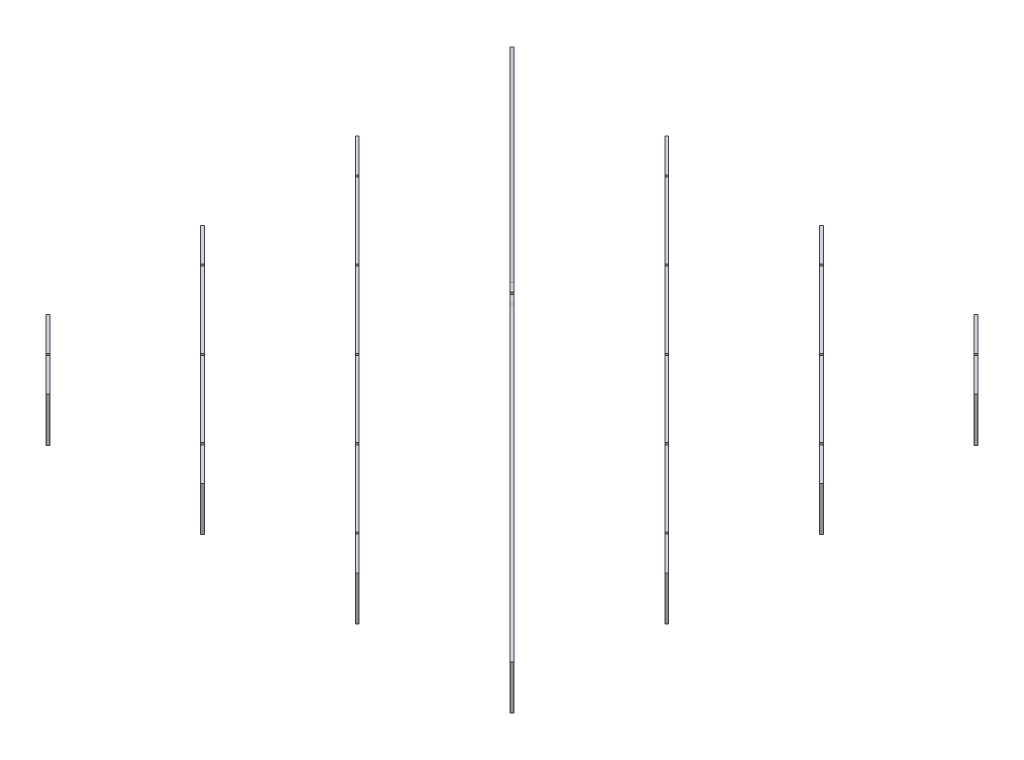
from build123d import *

# Parameters (mm, degrees)
BOSS_EXTRUDE1_DEPTH   = 100
BOSS_EXTRUDE1_2_DEPTH = 100
BOSS_EXTRUDE1_3_DEPTH = 100
BOSS_EXTRUDE1_4_DEPTH = 100
BOSS_EXTRUDE1_5_DEPTH = 100
BOSS_EXTRUDE1_6_DEPTH = 100
BOSS_EXTRUDE1_7_DEPTH = 100
BOSS_EXTRUDE2_START   = -6
BOSS_EXTRUDE2_DEPTH   = 6
SKETCH5_R             = 1.5
SKETCH5_W             = 6
SKETCH5_H             = 100
CUT_EXTRUDE1_DEPTH    = 500.974746831
CUT_EXTRUDE2_START    = -500.974746831
SKETCH6_R             = 1.5
SKETCH6_W             = 6
SKETCH6_H             = 100
CUT_EXTRUDE2_DEPTH    = 500.974746831
CUT_EXTRUDE3_DEPTH    = 6
SKETCH8_W             = 56
SKETCH8_H             = 12
CUT_EXTRUDE4_DEPTH    = 6
SKETCH9_R             = 4
SKETCH9_R_2           = 10
CUT_EXTRUDE5_DEPTH    = 6
CUT_EXTRUDE6_START    = -6
SKETCH10_R            = 3
CUT_EXTRUDE6_DEPTH    = 253.487373414


with BuildPart() as part:
    # Sketch2 → Boss-Extrude1 (new body)
    with BuildSketch(Plane(origin=(0, 0, 0), x_dir=(1, 0, 0), z_dir=(0, 1, 0))):
        Polygon((-605, -449.242640687), (-449.242640687, -605), (-445, -600.757359313), (-600.757359313, -445), align=None)
    extrude(amount=BOSS_EXTRUDE1_DEPTH)


with BuildPart() as body_2:
    # Sketch2 → Boss-Extrude1 2 (new body)
    with BuildSketch(Plane(origin=(0, 0, 0), x_dir=(1, 0, 0), z_dir=(0, 1, 0))):
        Polygon((-605, -99.242640687), (-99.242640687, -605), (-95, -600.757359313), (-600.757359313, -95), align=None)
    extrude(amount=BOSS_EXTRUDE1_2_DEPTH)


with BuildPart() as body_3:
    # Sketch2 → Boss-Extrude1 3 (new body)
    with BuildSketch(Plane(origin=(0, 0, 0), x_dir=(1, 0, 0), z_dir=(0, 1, 0))):
        Polygon((-605, 250.757359313), (250.757359313, -605), (255, -600.757359313), (-600.757359313, 255), align=None)
    extrude(amount=BOSS_EXTRUDE1_3_DEPTH)


with BuildPart() as body_4:
    # Sketch2 → Boss-Extrude1 4 (new body)
    with BuildSketch(Plane(origin=(0, 0, 0), x_dir=(1, 0, 0), z_dir=(0, 1, 0))):
        Polygon((605, -600.757359313), (-600.757359313, 605), (-605, 600.757359313), (600.757359313, -605), align=None)
    extrude(amount=BOSS_EXTRUDE1_4_DEPTH)

    # Sketch4 → Boss-Extrude2 (add)
    with BuildSketch(Plane(origin=(-2.121320344, 0, 2.121320344), x_dir=(0.7071067811865475, 0, 0.7071067811865477), z_dir=(-0.7071067811865477, 0, 0.7071067811865475)).offset(BOSS_EXTRUDE2_START)):
        Polygon((-30, 220), (-852.599205236, 100), (-30, 100), (30, 100), (852.599205236, 100), (30, 220), align=None)
    extrude(amount=BOSS_EXTRUDE2_DEPTH)

    # Sketch7 → Cut-Extrude3 (cut)
    with BuildSketch(Plane(origin=(-2.121320344, 0, 2.121320344), x_dir=(0.7071067811865475, 0, 0.7071067811865477), z_dir=(-0.7071067811865477, 0, 0.7071067811865475))):
        with BuildLine():
            ThreePointArc((-743.962120246, 50), (-746.522780418, 51.060660172), (-745.462120246, 48.5))
            Line((-745.462120246, 48.5), (-745.462120246, 50))
            Line((-745.462120246, 50), (-743.962120246, 50))
        make_face()
        with BuildLine():
            Line((-745.462120246, 50), (-745.462120246, 48.5))
            ThreePointArc((-745.462120246, 48.5), (-744.401460074, 48.939339828), (-743.962120246, 50))
            Line((-743.962120246, 50), (-745.462120246, 50))
        make_face()
        with BuildLine():
            ThreePointArc((-743.962120246, 50), (-746.522780418, 51.060660172), (-745.462120246, 48.5))
            Line((-745.462120246, 48.5), (-745.462120246, 50))
            Line((-745.462120246, 50), (-743.962120246, 50))
        make_face()
        with BuildLine():
            Line((-745.462120246, 50), (-745.462120246, 48.5))
            ThreePointArc((-745.462120246, 48.5), (-744.401460074, 48.939339828), (-743.962120246, 50))
            Line((-743.962120246, 50), (-745.462120246, 50))
        make_face()
        with BuildLine():
            Line((-745.462120246, 0), (-739.462120246, 0))
            Line((-739.462120246, 0), (-739.462120246, 48.5))
            ThreePointArc((-739.462120246, 48.5), (-740.522780418, 48.939339828), (-740.962120246, 50))
            Line((-740.962120246, 50), (-743.962120246, 50))
            ThreePointArc((-743.962120246, 50), (-744.401460074, 48.939339828), (-745.462120246, 48.5))
            Line((-745.462120246, 48.5), (-745.462120246, 0))
        make_face()
        with BuildLine():
            ThreePointArc((-740.962120246, 50), (-740.522780418, 48.939339828), (-739.462120246, 48.5))
            Line((-739.462120246, 48.5), (-739.462120246, 50))
            Line((-739.462120246, 50), (-740.962120246, 50))
        make_face()
        with BuildLine():
            Line((-739.462120246, 50), (-739.462120246, 48.5))
            ThreePointArc((-739.462120246, 48.5), (-738.401460074, 48.939339828), (-737.962120246, 50))
            ThreePointArc((-737.962120246, 50), (-739.462120246, 51.5), (-740.962120246, 50))
            Line((-740.962120246, 50), (-739.462120246, 50))
        make_face()
        with BuildLine():
            ThreePointArc((-740.962120246, 50), (-740.522780418, 48.939339828), (-739.462120246, 48.5))
            Line((-739.462120246, 48.5), (-739.462120246, 50))
            Line((-739.462120246, 50), (-740.962120246, 50))
        make_face()
        with BuildLine():
            Line((-739.462120246, 50), (-739.462120246, 48.5))
            ThreePointArc((-739.462120246, 48.5), (-738.401460074, 48.939339828), (-737.962120246, 50))
            ThreePointArc((-737.962120246, 50), (-739.462120246, 51.5), (-740.962120246, 50))
            Line((-740.962120246, 50), (-739.462120246, 50))
        make_face()
        with BuildLine():
            ThreePointArc((-496.474746831, 50), (-499.035407002, 51.060660172), (-497.974746831, 48.5))
            Line((-497.974746831, 48.5), (-497.974746831, 50))
            Line((-497.974746831, 50), (-496.474746831, 50))
        make_face()
        with BuildLine():
            Line((-497.974746831, 50), (-497.974746831, 48.5))
            ThreePointArc((-497.974746831, 48.5), (-496.914086659, 48.939339828), (-496.474746831, 50))
            Line((-496.474746831, 50), (-497.974746831, 50))
        make_face()
        with BuildLine():
            ThreePointArc((-496.474746831, 50), (-499.035407002, 51.060660172), (-497.974746831, 48.5))
            Line((-497.974746831, 48.5), (-497.974746831, 50))
            Line((-497.974746831, 50), (-496.474746831, 50))
        make_face()
        with BuildLine():
            Line((-497.974746831, 50), (-497.974746831, 48.5))
            ThreePointArc((-497.974746831, 48.5), (-496.914086659, 48.939339828), (-496.474746831, 50))
            Line((-496.474746831, 50), (-497.974746831, 50))
        make_face()
        with BuildLine():
            Line((-497.974746831, 0), (-491.974746831, 0))
            Line((-491.974746831, 0), (-491.974746831, 48.5))
            ThreePointArc((-491.974746831, 48.5), (-493.035407002, 48.939339828), (-493.474746831, 50))
            Line((-493.474746831, 50), (-496.474746831, 50))
            ThreePointArc((-496.474746831, 50), (-496.914086659, 48.939339828), (-497.974746831, 48.5))
            Line((-497.974746831, 48.5), (-497.974746831, 0))
        make_face()
        with BuildLine():
            ThreePointArc((-493.474746831, 50), (-493.035407002, 48.939339828), (-491.974746831, 48.5))
            Line((-491.974746831, 48.5), (-491.974746831, 50))
            Line((-491.974746831, 50), (-493.474746831, 50))
        make_face()
        with BuildLine():
            Line((-491.974746831, 50), (-491.974746831, 48.5))
            ThreePointArc((-491.974746831, 48.5), (-490.914086659, 48.939339828), (-490.474746831, 50))
            ThreePointArc((-490.474746831, 50), (-491.974746831, 51.5), (-493.474746831, 50))
            Line((-493.474746831, 50), (-491.974746831, 50))
        make_face()
        with BuildLine():
            ThreePointArc((-493.474746831, 50), (-493.035407002, 48.939339828), (-491.974746831, 48.5))
            Line((-491.974746831, 48.5), (-491.974746831, 50))
            Line((-491.974746831, 50), (-493.474746831, 50))
        make_face()
        with BuildLine():
            Line((-491.974746831, 50), (-491.974746831, 48.5))
            ThreePointArc((-491.974746831, 48.5), (-490.914086659, 48.939339828), (-490.474746831, 50))
            ThreePointArc((-490.474746831, 50), (-491.974746831, 51.5), (-493.474746831, 50))
            Line((-493.474746831, 50), (-491.974746831, 50))
        make_face()
        with BuildLine():
            ThreePointArc((-242.987373415, 50), (-244.487373415, 51.5), (-245.987373415, 50))
            Line((-245.987373415, 50), (-244.487373415, 50))
            Line((-244.487373415, 50), (-244.487373415, 48.5))
            ThreePointArc((-244.487373415, 48.5), (-243.426713244, 48.939339828), (-242.987373415, 50))
        make_face()
        with BuildLine():
            Line((-244.487373415, 50), (-245.987373415, 50))
            ThreePointArc((-245.987373415, 50), (-245.548033587, 48.939339828), (-244.487373415, 48.5))
            Line((-244.487373415, 48.5), (-244.487373415, 50))
        make_face()
        with BuildLine():
            ThreePointArc((-242.987373415, 50), (-244.487373415, 51.5), (-245.987373415, 50))
            Line((-245.987373415, 50), (-244.487373415, 50))
            Line((-244.487373415, 50), (-244.487373415, 48.5))
            ThreePointArc((-244.487373415, 48.5), (-243.426713244, 48.939339828), (-242.987373415, 50))
        make_face()
        with BuildLine():
            Line((-244.487373415, 50), (-245.987373415, 50))
            ThreePointArc((-245.987373415, 50), (-245.548033587, 48.939339828), (-244.487373415, 48.5))
            Line((-244.487373415, 48.5), (-244.487373415, 50))
        make_face()
        with BuildLine():
            Line((-245.987373415, 50), (-248.987373415, 50))
            ThreePointArc((-248.987373415, 50), (-249.426713244, 48.939339828), (-250.487373415, 48.5))
            Line((-250.487373415, 48.5), (-250.487373415, 0))
            Line((-250.487373415, 0), (-244.487373415, 0))
            Line((-244.487373415, 0), (-244.487373415, 48.5))
            ThreePointArc((-244.487373415, 48.5), (-245.548033587, 48.939339828), (-245.987373415, 50))
        make_face()
        with BuildLine():
            Line((-250.487373415, 48.5), (-250.487373415, 50))
            Line((-250.487373415, 50), (-248.987373415, 50))
            ThreePointArc((-248.987373415, 50), (-251.548033587, 51.060660172), (-250.487373415, 48.5))
        make_face()
        with BuildLine():
            Line((-248.987373415, 50), (-250.487373415, 50))
            Line((-250.487373415, 50), (-250.487373415, 48.5))
            ThreePointArc((-250.487373415, 48.5), (-249.426713244, 48.939339828), (-248.987373415, 50))
        make_face()
        with BuildLine():
            Line((-250.487373415, 48.5), (-250.487373415, 50))
            Line((-250.487373415, 50), (-248.987373415, 50))
            ThreePointArc((-248.987373415, 50), (-251.548033587, 51.060660172), (-250.487373415, 48.5))
        make_face()
        with BuildLine():
            Line((-248.987373415, 50), (-250.487373415, 50))
            Line((-250.487373415, 50), (-250.487373415, 48.5))
            ThreePointArc((-250.487373415, 48.5), (-249.426713244, 48.939339828), (-248.987373415, 50))
        make_face()
        with BuildLine():
            Line((3, 220), (-3, 220))
            Line((-3, 220), (-3, 111.5))
            ThreePointArc((-3, 111.5), (-1.939339828, 111.060660172), (-1.5, 110))
            Line((-1.5, 110), (1.5, 110))
            ThreePointArc((1.5, 110), (1.939339828, 111.060660172), (3, 111.5))
            Line((3, 111.5), (3, 220))
        make_face()
        with BuildLine():
            ThreePointArc((-1.5, 110), (-1.939339828, 111.060660172), (-3, 111.5))
            Line((-3, 111.5), (-3, 110))
            Line((-3, 110), (-1.5, 110))
        make_face()
        with BuildLine():
            Line((-3, 110), (-3, 111.5))
            ThreePointArc((-3, 111.5), (-4.060660172, 108.939339828), (-1.5, 110))
            Line((-1.5, 110), (-3, 110))
        make_face()
        with BuildLine():
            ThreePointArc((-1.5, 110), (-1.939339828, 111.060660172), (-3, 111.5))
            Line((-3, 111.5), (-3, 110))
            Line((-3, 110), (-1.5, 110))
        make_face()
        with BuildLine():
            Line((-3, 110), (-3, 111.5))
            ThreePointArc((-3, 111.5), (-4.060660172, 108.939339828), (-1.5, 110))
            Line((-1.5, 110), (-3, 110))
        make_face()
        with BuildLine():
            ThreePointArc((4.5, 110), (4.060660172, 111.060660172), (3, 111.5))
            Line((3, 111.5), (3, 110))
            Line((3, 110), (1.5, 110))
            ThreePointArc((1.5, 110), (3, 108.5), (4.5, 110))
        make_face()
        with BuildLine():
            Line((3, 110), (3, 111.5))
            ThreePointArc((3, 111.5), (1.939339828, 111.060660172), (1.5, 110))
            Line((1.5, 110), (3, 110))
        make_face()
        with BuildLine():
            ThreePointArc((4.5, 110), (4.060660172, 111.060660172), (3, 111.5))
            Line((3, 111.5), (3, 110))
            Line((3, 110), (1.5, 110))
            ThreePointArc((1.5, 110), (3, 108.5), (4.5, 110))
        make_face()
        with BuildLine():
            Line((3, 110), (3, 111.5))
            ThreePointArc((3, 111.5), (1.939339828, 111.060660172), (1.5, 110))
            Line((1.5, 110), (3, 110))
        make_face()
        with BuildLine():
            ThreePointArc((245.987373415, 50), (243.426713244, 51.060660172), (244.487373415, 48.5))
            Line((244.487373415, 48.5), (244.487373415, 50))
            Line((244.487373415, 50), (245.987373415, 50))
        make_face()
        with BuildLine():
            Line((244.487373415, 50), (244.487373415, 48.5))
            ThreePointArc((244.487373415, 48.5), (245.548033587, 48.939339828), (245.987373415, 50))
            Line((245.987373415, 50), (244.487373415, 50))
        make_face()
        with BuildLine():
            ThreePointArc((245.987373415, 50), (243.426713244, 51.060660172), (244.487373415, 48.5))
            Line((244.487373415, 48.5), (244.487373415, 50))
            Line((244.487373415, 50), (245.987373415, 50))
        make_face()
        with BuildLine():
            Line((244.487373415, 50), (244.487373415, 48.5))
            ThreePointArc((244.487373415, 48.5), (245.548033587, 48.939339828), (245.987373415, 50))
            Line((245.987373415, 50), (244.487373415, 50))
        make_face()
        with BuildLine():
            Line((244.487373415, 48.5), (244.487373415, 0))
            Line((244.487373415, 0), (250.487373415, 0))
            Line((250.487373415, 0), (250.487373415, 48.5))
            ThreePointArc((250.487373415, 48.5), (249.426713244, 48.939339828), (248.987373415, 50))
            Line((248.987373415, 50), (245.987373415, 50))
            ThreePointArc((245.987373415, 50), (245.548033587, 48.939339828), (244.487373415, 48.5))
        make_face()
        with BuildLine():
            ThreePointArc((248.987373415, 50), (249.426713244, 48.939339828), (250.487373415, 48.5))
            Line((250.487373415, 48.5), (250.487373415, 50))
            Line((250.487373415, 50), (248.987373415, 50))
        make_face()
        with BuildLine():
            Line((250.487373415, 50), (250.487373415, 48.5))
            ThreePointArc((250.487373415, 48.5), (251.548033587, 48.939339828), (251.987373415, 50))
            ThreePointArc((251.987373415, 50), (250.487373415, 51.5), (248.987373415, 50))
            Line((248.987373415, 50), (250.487373415, 50))
        make_face()
        with BuildLine():
            ThreePointArc((248.987373415, 50), (249.426713244, 48.939339828), (250.487373415, 48.5))
            Line((250.487373415, 48.5), (250.487373415, 50))
            Line((250.487373415, 50), (248.987373415, 50))
        make_face()
        with BuildLine():
            Line((250.487373415, 50), (250.487373415, 48.5))
            ThreePointArc((250.487373415, 48.5), (251.548033587, 48.939339828), (251.987373415, 50))
            ThreePointArc((251.987373415, 50), (250.487373415, 51.5), (248.987373415, 50))
            Line((248.987373415, 50), (250.487373415, 50))
        make_face()
        with BuildLine():
            ThreePointArc((493.474746831, 50), (490.914086659, 51.060660172), (491.974746831, 48.5))
            Line((491.974746831, 48.5), (491.974746831, 50))
            Line((491.974746831, 50), (493.474746831, 50))
        make_face()
        with BuildLine():
            Line((491.974746831, 50), (491.974746831, 48.5))
            ThreePointArc((491.974746831, 48.5), (493.035407002, 48.939339828), (493.474746831, 50))
            Line((493.474746831, 50), (491.974746831, 50))
        make_face()
        with BuildLine():
            ThreePointArc((493.474746831, 50), (490.914086659, 51.060660172), (491.974746831, 48.5))
            Line((491.974746831, 48.5), (491.974746831, 50))
            Line((491.974746831, 50), (493.474746831, 50))
        make_face()
        with BuildLine():
            Line((491.974746831, 50), (491.974746831, 48.5))
            ThreePointArc((491.974746831, 48.5), (493.035407002, 48.939339828), (493.474746831, 50))
            Line((493.474746831, 50), (491.974746831, 50))
        make_face()
        with BuildLine():
            Line((491.974746831, 48.5), (491.974746831, 0))
            Line((491.974746831, 0), (497.974746831, 0))
            Line((497.974746831, 0), (497.974746831, 48.5))
            ThreePointArc((497.974746831, 48.5), (496.914086659, 48.939339828), (496.474746831, 50))
            Line((496.474746831, 50), (493.474746831, 50))
            ThreePointArc((493.474746831, 50), (493.035407002, 48.939339828), (491.974746831, 48.5))
        make_face()
        with BuildLine():
            ThreePointArc((496.474746831, 50), (496.914086659, 48.939339828), (497.974746831, 48.5))
            Line((497.974746831, 48.5), (497.974746831, 50))
            Line((497.974746831, 50), (496.474746831, 50))
        make_face()
        with BuildLine():
            Line((497.974746831, 50), (497.974746831, 48.5))
            ThreePointArc((497.974746831, 48.5), (499.035407002, 48.939339828), (499.474746831, 50))
            ThreePointArc((499.474746831, 50), (497.974746831, 51.5), (496.474746831, 50))
            Line((496.474746831, 50), (497.974746831, 50))
        make_face()
        with BuildLine():
            ThreePointArc((496.474746831, 50), (496.914086659, 48.939339828), (497.974746831, 48.5))
            Line((497.974746831, 48.5), (497.974746831, 50))
            Line((497.974746831, 50), (496.474746831, 50))
        make_face()
        with BuildLine():
            Line((497.974746831, 50), (497.974746831, 48.5))
            ThreePointArc((497.974746831, 48.5), (499.035407002, 48.939339828), (499.474746831, 50))
            ThreePointArc((499.474746831, 50), (497.974746831, 51.5), (496.474746831, 50))
            Line((496.474746831, 50), (497.974746831, 50))
        make_face()
        with BuildLine():
            ThreePointArc((740.962120246, 50), (738.401460074, 51.060660172), (739.462120246, 48.5))
            Line((739.462120246, 48.5), (739.462120246, 50))
            Line((739.462120246, 50), (740.962120246, 50))
        make_face()
        with BuildLine():
            Line((739.462120246, 50), (739.462120246, 48.5))
            ThreePointArc((739.462120246, 48.5), (740.522780418, 48.939339828), (740.962120246, 50))
            Line((740.962120246, 50), (739.462120246, 50))
        make_face()
        with BuildLine():
            ThreePointArc((740.962120246, 50), (738.401460074, 51.060660172), (739.462120246, 48.5))
            Line((739.462120246, 48.5), (739.462120246, 50))
            Line((739.462120246, 50), (740.962120246, 50))
        make_face()
        with BuildLine():
            Line((739.462120246, 50), (739.462120246, 48.5))
            ThreePointArc((739.462120246, 48.5), (740.522780418, 48.939339828), (740.962120246, 50))
            Line((740.962120246, 50), (739.462120246, 50))
        make_face()
        with BuildLine():
            Line((739.462120246, 48.5), (739.462120246, 0))
            Line((739.462120246, 0), (745.462120246, 0))
            Line((745.462120246, 0), (745.462120246, 48.5))
            ThreePointArc((745.462120246, 48.5), (744.401460074, 48.939339828), (743.962120246, 50))
            Line((743.962120246, 50), (740.962120246, 50))
            ThreePointArc((740.962120246, 50), (740.522780418, 48.939339828), (739.462120246, 48.5))
        make_face()
        with BuildLine():
            ThreePointArc((743.962120246, 50), (744.401460074, 48.939339828), (745.462120246, 48.5))
            Line((745.462120246, 48.5), (745.462120246, 50))
            Line((745.462120246, 50), (743.962120246, 50))
        make_face()
        with BuildLine():
            Line((745.462120246, 50), (745.462120246, 48.5))
            ThreePointArc((745.462120246, 48.5), (746.522780418, 48.939339828), (746.962120246, 50))
            ThreePointArc((746.962120246, 50), (745.462120246, 51.5), (743.962120246, 50))
            Line((743.962120246, 50), (745.462120246, 50))
        make_face()
        with BuildLine():
            ThreePointArc((743.962120246, 50), (744.401460074, 48.939339828), (745.462120246, 48.5))
            Line((745.462120246, 48.5), (745.462120246, 50))
            Line((745.462120246, 50), (743.962120246, 50))
        make_face()
        with BuildLine():
            Line((745.462120246, 50), (745.462120246, 48.5))
            ThreePointArc((745.462120246, 48.5), (746.522780418, 48.939339828), (746.962120246, 50))
            ThreePointArc((746.962120246, 50), (745.462120246, 51.5), (743.962120246, 50))
            Line((743.962120246, 50), (745.462120246, 50))
        make_face()
    extrude(amount=-CUT_EXTRUDE3_DEPTH, mode=Mode.SUBTRACT)

    # Sketch8 → Cut-Extrude4 (cut)
    with BuildSketch(Plane(origin=(-2.121320344, 0, 2.121320344), x_dir=(0.7071067811865475, 0, 0.7071067811865477), z_dir=(-0.7071067811865477, 0, 0.7071067811865475))):
        with Locations((371.231060123, 22)):
            Rectangle(SKETCH8_W, SKETCH8_H)
        with Locations((-371.231060123, 22)):
            Rectangle(SKETCH8_W, SKETCH8_H)
    extrude(amount=-CUT_EXTRUDE4_DEPTH, mode=Mode.SUBTRACT)

    # Sketch9 → Cut-Extrude5 (cut)
    with BuildSketch(Plane(origin=(2.121320344, 0, -2.121320344), x_dir=(-0.7071067811865475, 0, -0.7071067811865477), z_dir=(0.7071067811865477, 0, -0.7071067811865475))):
        with Locations((123.743686708, 64)):
            Circle(SKETCH9_R)
        with Locations((123.743686708, 84)):
            Circle(SKETCH9_R)
        with Locations((40, 74)):
            Circle(SKETCH9_R_2)
        with Locations((-40, 74)):
            Circle(SKETCH9_R_2)
        with Locations((-123.743686708, 84)):
            Circle(SKETCH9_R)
        with Locations((-123.743686708, 64)):
            Circle(SKETCH9_R)
    extrude(amount=-CUT_EXTRUDE5_DEPTH, mode=Mode.SUBTRACT)


with BuildPart() as body_5:
    # Sketch2 → Boss-Extrude1 5 (new body)
    with BuildSketch(Plane(origin=(0, 0, 0), x_dir=(1, 0, 0), z_dir=(0, 1, 0))):
        Polygon((-255, 600.757359313), (600.757359313, -255), (605, -250.757359313), (-250.757359313, 605), align=None)
    extrude(amount=BOSS_EXTRUDE1_5_DEPTH)


with BuildPart() as body_6:
    # Sketch2 → Boss-Extrude1 6 (new body)
    with BuildSketch(Plane(origin=(0, 0, 0), x_dir=(1, 0, 0), z_dir=(0, 1, 0))):
        Polygon((95, 600.757359313), (600.757359313, 95), (605, 99.242640687), (99.242640687, 605), align=None)
    extrude(amount=BOSS_EXTRUDE1_6_DEPTH)


with BuildPart() as body_7:
    # Sketch2 → Boss-Extrude1 7 (new body)
    with BuildSketch(Plane(origin=(0, 0, 0), x_dir=(1, 0, 0), z_dir=(0, 1, 0))):
        Polygon((445, 600.757359313), (600.757359313, 445), (605, 449.242640687), (449.242640687, 605), align=None)
    extrude(amount=BOSS_EXTRUDE1_7_DEPTH)


with BuildPart() as cut_extrude1_tool:
    # Sketch5 → Cut-Extrude1 (new body)
    with BuildSketch(Plane(origin=(-527.121320344, 0, 527.121320344), x_dir=(0.707106781186544, 0, 0.7071067811865511), z_dir=(-0.7071067811865511, 0, 0.707106781186544))):
        with Locations((497.974746831, 50)):
            Circle(SKETCH5_R)
        with Locations((491.974746831, 50)):
            Circle(SKETCH5_R)
        with Locations((494.974746831, 100)):
            Rectangle(SKETCH5_W, SKETCH5_H)
        with BuildLine():
            ThreePointArc((493.474746831, 50), (493.035407002, 51.060660172), (491.974746831, 51.5))
            Line((491.974746831, 51.5), (491.974746831, 50))
            Line((491.974746831, 50), (493.474746831, 50))
        make_face()
        with BuildLine():
            Line((491.974746831, 50), (491.974746831, 51.5))
            ThreePointArc((491.974746831, 51.5), (490.914086659, 48.939339828), (493.474746831, 50))
            Line((493.474746831, 50), (491.974746831, 50))
        make_face()
        with BuildLine():
            ThreePointArc((493.474746831, 50), (493.035407002, 51.060660172), (491.974746831, 51.5))
            Line((491.974746831, 51.5), (491.974746831, 50))
            Line((491.974746831, 50), (493.474746831, 50))
        make_face()
        with BuildLine():
            Line((491.974746831, 50), (491.974746831, 51.5))
            ThreePointArc((491.974746831, 51.5), (490.914086659, 48.939339828), (493.474746831, 50))
            Line((493.474746831, 50), (491.974746831, 50))
        make_face()
        with BuildLine():
            ThreePointArc((499.474746831, 50), (499.035407002, 51.060660172), (497.974746831, 51.5))
            Line((497.974746831, 51.5), (497.974746831, 50))
            Line((497.974746831, 50), (496.474746831, 50))
            ThreePointArc((496.474746831, 50), (497.974746831, 48.5), (499.474746831, 50))
        make_face()
        with BuildLine():
            Line((497.974746831, 50), (497.974746831, 51.5))
            ThreePointArc((497.974746831, 51.5), (496.914086659, 51.060660172), (496.474746831, 50))
            Line((496.474746831, 50), (497.974746831, 50))
        make_face()
        with BuildLine():
            ThreePointArc((499.474746831, 50), (499.035407002, 51.060660172), (497.974746831, 51.5))
            Line((497.974746831, 51.5), (497.974746831, 50))
            Line((497.974746831, 50), (496.474746831, 50))
            ThreePointArc((496.474746831, 50), (497.974746831, 48.5), (499.474746831, 50))
        make_face()
        with BuildLine():
            Line((497.974746831, 50), (497.974746831, 51.5))
            ThreePointArc((497.974746831, 51.5), (496.914086659, 51.060660172), (496.474746831, 50))
            Line((496.474746831, 50), (497.974746831, 50))
        make_face()
        with Locations((250.487373415, 50)):
            Circle(SKETCH5_R)
        with Locations((244.487373415, 50)):
            Circle(SKETCH5_R)
        with Locations((247.487373415, 100)):
            Rectangle(SKETCH5_W, SKETCH5_H)
        with BuildLine():
            ThreePointArc((245.987373415, 50), (245.548033587, 51.060660172), (244.487373415, 51.5))
            Line((244.487373415, 51.5), (244.487373415, 50))
            Line((244.487373415, 50), (245.987373415, 50))
        make_face()
        with BuildLine():
            Line((244.487373415, 50), (244.487373415, 51.5))
            ThreePointArc((244.487373415, 51.5), (243.426713244, 48.939339828), (245.987373415, 50))
            Line((245.987373415, 50), (244.487373415, 50))
        make_face()
        with BuildLine():
            ThreePointArc((245.987373415, 50), (245.548033587, 51.060660172), (244.487373415, 51.5))
            Line((244.487373415, 51.5), (244.487373415, 50))
            Line((244.487373415, 50), (245.987373415, 50))
        make_face()
        with BuildLine():
            Line((244.487373415, 50), (244.487373415, 51.5))
            ThreePointArc((244.487373415, 51.5), (243.426713244, 48.939339828), (245.987373415, 50))
            Line((245.987373415, 50), (244.487373415, 50))
        make_face()
        with BuildLine():
            ThreePointArc((251.987373415, 50), (251.548033587, 51.060660172), (250.487373415, 51.5))
            Line((250.487373415, 51.5), (250.487373415, 50))
            Line((250.487373415, 50), (248.987373415, 50))
            ThreePointArc((248.987373415, 50), (250.487373415, 48.5), (251.987373415, 50))
        make_face()
        with BuildLine():
            Line((250.487373415, 50), (250.487373415, 51.5))
            ThreePointArc((250.487373415, 51.5), (249.426713244, 51.060660172), (248.987373415, 50))
            Line((248.987373415, 50), (250.487373415, 50))
        make_face()
        with BuildLine():
            ThreePointArc((251.987373415, 50), (251.548033587, 51.060660172), (250.487373415, 51.5))
            Line((250.487373415, 51.5), (250.487373415, 50))
            Line((250.487373415, 50), (248.987373415, 50))
            ThreePointArc((248.987373415, 50), (250.487373415, 48.5), (251.987373415, 50))
        make_face()
        with BuildLine():
            Line((250.487373415, 50), (250.487373415, 51.5))
            ThreePointArc((250.487373415, 51.5), (249.426713244, 51.060660172), (248.987373415, 50))
            Line((248.987373415, 50), (250.487373415, 50))
        make_face()
        with BuildLine():
            Line((3, 100), (-3, 100))
            Line((-3, 100), (-3, 51.5))
            ThreePointArc((-3, 51.5), (-1.939339828, 51.060660172), (-1.5, 50))
            Line((-1.5, 50), (1.5, 50))
            ThreePointArc((1.5, 50), (1.939339828, 51.060660172), (3, 51.5))
            Line((3, 51.5), (3, 100))
        make_face()
        with BuildLine():
            ThreePointArc((-1.5, 50), (-1.939339828, 51.060660172), (-3, 51.5))
            Line((-3, 51.5), (-3, 50))
            Line((-3, 50), (-1.5, 50))
        make_face()
        with BuildLine():
            Line((-3, 50), (-3, 51.5))
            ThreePointArc((-3, 51.5), (-4.060660172, 48.939339828), (-1.5, 50))
            Line((-1.5, 50), (-3, 50))
        make_face()
        with BuildLine():
            ThreePointArc((-1.5, 50), (-1.939339828, 51.060660172), (-3, 51.5))
            Line((-3, 51.5), (-3, 50))
            Line((-3, 50), (-1.5, 50))
        make_face()
        with BuildLine():
            Line((-3, 50), (-3, 51.5))
            ThreePointArc((-3, 51.5), (-4.060660172, 48.939339828), (-1.5, 50))
            Line((-1.5, 50), (-3, 50))
        make_face()
        with BuildLine():
            ThreePointArc((4.5, 50), (4.060660172, 51.060660172), (3, 51.5))
            Line((3, 51.5), (3, 50))
            Line((3, 50), (1.5, 50))
            ThreePointArc((1.5, 50), (3, 48.5), (4.5, 50))
        make_face()
        with BuildLine():
            Line((3, 50), (3, 51.5))
            ThreePointArc((3, 51.5), (1.939339828, 51.060660172), (1.5, 50))
            Line((1.5, 50), (3, 50))
        make_face()
        with BuildLine():
            ThreePointArc((4.5, 50), (4.060660172, 51.060660172), (3, 51.5))
            Line((3, 51.5), (3, 50))
            Line((3, 50), (1.5, 50))
            ThreePointArc((1.5, 50), (3, 48.5), (4.5, 50))
        make_face()
        with BuildLine():
            Line((3, 50), (3, 51.5))
            ThreePointArc((3, 51.5), (1.939339828, 51.060660172), (1.5, 50))
            Line((1.5, 50), (3, 50))
        make_face()
        with Locations((-244.487373415, 50)):
            Circle(SKETCH5_R)
        with Locations((-250.487373415, 50)):
            Circle(SKETCH5_R)
        with Locations((-247.487373415, 100)):
            Rectangle(SKETCH5_W, SKETCH5_H)
        with BuildLine():
            ThreePointArc((-248.987373415, 50), (-249.426713244, 51.060660172), (-250.487373415, 51.5))
            Line((-250.487373415, 51.5), (-250.487373415, 50))
            Line((-250.487373415, 50), (-248.987373415, 50))
        make_face()
        with BuildLine():
            Line((-250.487373415, 50), (-250.487373415, 51.5))
            ThreePointArc((-250.487373415, 51.5), (-251.548033587, 48.939339828), (-248.987373415, 50))
            Line((-248.987373415, 50), (-250.487373415, 50))
        make_face()
        with BuildLine():
            ThreePointArc((-248.987373415, 50), (-249.426713244, 51.060660172), (-250.487373415, 51.5))
            Line((-250.487373415, 51.5), (-250.487373415, 50))
            Line((-250.487373415, 50), (-248.987373415, 50))
        make_face()
        with BuildLine():
            Line((-250.487373415, 50), (-250.487373415, 51.5))
            ThreePointArc((-250.487373415, 51.5), (-251.548033587, 48.939339828), (-248.987373415, 50))
            Line((-248.987373415, 50), (-250.487373415, 50))
        make_face()
        with BuildLine():
            ThreePointArc((-242.987373415, 50), (-243.426713244, 51.060660172), (-244.487373415, 51.5))
            Line((-244.487373415, 51.5), (-244.487373415, 50))
            Line((-244.487373415, 50), (-245.987373415, 50))
            ThreePointArc((-245.987373415, 50), (-244.487373415, 48.5), (-242.987373415, 50))
        make_face()
        with BuildLine():
            Line((-244.487373415, 50), (-244.487373415, 51.5))
            ThreePointArc((-244.487373415, 51.5), (-245.548033587, 51.060660172), (-245.987373415, 50))
            Line((-245.987373415, 50), (-244.487373415, 50))
        make_face()
        with BuildLine():
            ThreePointArc((-242.987373415, 50), (-243.426713244, 51.060660172), (-244.487373415, 51.5))
            Line((-244.487373415, 51.5), (-244.487373415, 50))
            Line((-244.487373415, 50), (-245.987373415, 50))
            ThreePointArc((-245.987373415, 50), (-244.487373415, 48.5), (-242.987373415, 50))
        make_face()
        with BuildLine():
            Line((-244.487373415, 50), (-244.487373415, 51.5))
            ThreePointArc((-244.487373415, 51.5), (-245.548033587, 51.060660172), (-245.987373415, 50))
            Line((-245.987373415, 50), (-244.487373415, 50))
        make_face()
        with Locations((-491.974746831, 50)):
            Circle(SKETCH5_R)
        with Locations((-497.974746831, 50)):
            Circle(SKETCH5_R)
        with Locations((-494.974746831, 100)):
            Rectangle(SKETCH5_W, SKETCH5_H)
        with BuildLine():
            ThreePointArc((-496.474746831, 50), (-496.914086659, 51.060660172), (-497.974746831, 51.5))
            Line((-497.974746831, 51.5), (-497.974746831, 50))
            Line((-497.974746831, 50), (-496.474746831, 50))
        make_face()
        with BuildLine():
            Line((-497.974746831, 50), (-497.974746831, 51.5))
            ThreePointArc((-497.974746831, 51.5), (-499.035407002, 48.939339828), (-496.474746831, 50))
            Line((-496.474746831, 50), (-497.974746831, 50))
        make_face()
        with BuildLine():
            ThreePointArc((-496.474746831, 50), (-496.914086659, 51.060660172), (-497.974746831, 51.5))
            Line((-497.974746831, 51.5), (-497.974746831, 50))
            Line((-497.974746831, 50), (-496.474746831, 50))
        make_face()
        with BuildLine():
            Line((-497.974746831, 50), (-497.974746831, 51.5))
            ThreePointArc((-497.974746831, 51.5), (-499.035407002, 48.939339828), (-496.474746831, 50))
            Line((-496.474746831, 50), (-497.974746831, 50))
        make_face()
        with BuildLine():
            ThreePointArc((-490.474746831, 50), (-490.914086659, 51.060660172), (-491.974746831, 51.5))
            Line((-491.974746831, 51.5), (-491.974746831, 50))
            Line((-491.974746831, 50), (-493.474746831, 50))
            ThreePointArc((-493.474746831, 50), (-491.974746831, 48.5), (-490.474746831, 50))
        make_face()
        with BuildLine():
            Line((-491.974746831, 50), (-491.974746831, 51.5))
            ThreePointArc((-491.974746831, 51.5), (-493.035407002, 51.060660172), (-493.474746831, 50))
            Line((-493.474746831, 50), (-491.974746831, 50))
        make_face()
        with BuildLine():
            ThreePointArc((-490.474746831, 50), (-490.914086659, 51.060660172), (-491.974746831, 51.5))
            Line((-491.974746831, 51.5), (-491.974746831, 50))
            Line((-491.974746831, 50), (-493.474746831, 50))
            ThreePointArc((-493.474746831, 50), (-491.974746831, 48.5), (-490.474746831, 50))
        make_face()
        with BuildLine():
            Line((-491.974746831, 50), (-491.974746831, 51.5))
            ThreePointArc((-491.974746831, 51.5), (-493.035407002, 51.060660172), (-493.474746831, 50))
            Line((-493.474746831, 50), (-491.974746831, 50))
        make_face()
    extrude(amount=-CUT_EXTRUDE1_DEPTH)


with BuildPart() as part_1:
    add(part.part)

    # Cut-Extrude1: cut by cut_extrude1_tool
    add(cut_extrude1_tool.part, mode=Mode.SUBTRACT)


with BuildPart() as body_2_1:
    add(body_2.part)

    # Cut-Extrude1: cut by cut_extrude1_tool
    add(cut_extrude1_tool.part, mode=Mode.SUBTRACT)


with BuildPart() as body_3_1:
    add(body_3.part)

    # Cut-Extrude1: cut by cut_extrude1_tool
    add(cut_extrude1_tool.part, mode=Mode.SUBTRACT)


with BuildPart() as cut_extrude2_tool:
    # Sketch6 → Cut-Extrude2 (new body)
    with BuildSketch(Plane(origin=(527.121320344, 0, -527.121320344), x_dir=(-0.7071067811865511, 0, -0.707106781186544), z_dir=(0.707106781186544, 0, -0.7071067811865511)).offset(CUT_EXTRUDE2_START)):
        with Locations((-491.974746831, 50)):
            Circle(SKETCH6_R)
        with Locations((-497.974746831, 50)):
            Circle(SKETCH6_R)
        with Locations((-494.974746831, 100)):
            Rectangle(SKETCH6_W, SKETCH6_H)
        with BuildLine():
            ThreePointArc((-497.974746831, 51.5), (-499.035407002, 48.939339828), (-496.474746831, 50))
            Line((-496.474746831, 50), (-497.974746831, 50))
            Line((-497.974746831, 50), (-497.974746831, 51.5))
        make_face()
        with BuildLine():
            Line((-497.974746831, 50), (-496.474746831, 50))
            ThreePointArc((-496.474746831, 50), (-496.914086659, 51.060660172), (-497.974746831, 51.5))
            Line((-497.974746831, 51.5), (-497.974746831, 50))
        make_face()
        with BuildLine():
            ThreePointArc((-497.974746831, 51.5), (-499.035407002, 48.939339828), (-496.474746831, 50))
            Line((-496.474746831, 50), (-497.974746831, 50))
            Line((-497.974746831, 50), (-497.974746831, 51.5))
        make_face()
        with BuildLine():
            Line((-497.974746831, 50), (-496.474746831, 50))
            ThreePointArc((-496.474746831, 50), (-496.914086659, 51.060660172), (-497.974746831, 51.5))
            Line((-497.974746831, 51.5), (-497.974746831, 50))
        make_face()
        with BuildLine():
            Line((-493.474746831, 50), (-491.974746831, 50))
            Line((-491.974746831, 50), (-491.974746831, 51.5))
            ThreePointArc((-491.974746831, 51.5), (-493.035407002, 51.060660172), (-493.474746831, 50))
        make_face()
        with BuildLine():
            Line((-491.974746831, 51.5), (-491.974746831, 50))
            Line((-491.974746831, 50), (-493.474746831, 50))
            ThreePointArc((-493.474746831, 50), (-491.974746831, 48.5), (-490.474746831, 50))
            ThreePointArc((-490.474746831, 50), (-490.914086659, 51.060660172), (-491.974746831, 51.5))
        make_face()
        with BuildLine():
            Line((-493.474746831, 50), (-491.974746831, 50))
            Line((-491.974746831, 50), (-491.974746831, 51.5))
            ThreePointArc((-491.974746831, 51.5), (-493.035407002, 51.060660172), (-493.474746831, 50))
        make_face()
        with BuildLine():
            Line((-491.974746831, 51.5), (-491.974746831, 50))
            Line((-491.974746831, 50), (-493.474746831, 50))
            ThreePointArc((-493.474746831, 50), (-491.974746831, 48.5), (-490.474746831, 50))
            ThreePointArc((-490.474746831, 50), (-490.914086659, 51.060660172), (-491.974746831, 51.5))
        make_face()
        with Locations((-244.487373415, 50)):
            Circle(SKETCH6_R)
        with Locations((-250.487373415, 50)):
            Circle(SKETCH6_R)
        with Locations((-247.487373415, 100)):
            Rectangle(SKETCH6_W, SKETCH6_H)
        with BuildLine():
            ThreePointArc((-250.487373415, 51.5), (-251.548033587, 48.939339828), (-248.987373415, 50))
            Line((-248.987373415, 50), (-250.487373415, 50))
            Line((-250.487373415, 50), (-250.487373415, 51.5))
        make_face()
        with BuildLine():
            Line((-250.487373415, 50), (-248.987373415, 50))
            ThreePointArc((-248.987373415, 50), (-249.426713244, 51.060660172), (-250.487373415, 51.5))
            Line((-250.487373415, 51.5), (-250.487373415, 50))
        make_face()
        with BuildLine():
            ThreePointArc((-250.487373415, 51.5), (-251.548033587, 48.939339828), (-248.987373415, 50))
            Line((-248.987373415, 50), (-250.487373415, 50))
            Line((-250.487373415, 50), (-250.487373415, 51.5))
        make_face()
        with BuildLine():
            Line((-250.487373415, 50), (-248.987373415, 50))
            ThreePointArc((-248.987373415, 50), (-249.426713244, 51.060660172), (-250.487373415, 51.5))
            Line((-250.487373415, 51.5), (-250.487373415, 50))
        make_face()
        with BuildLine():
            Line((-245.987373415, 50), (-244.487373415, 50))
            Line((-244.487373415, 50), (-244.487373415, 51.5))
            ThreePointArc((-244.487373415, 51.5), (-245.548033587, 51.060660172), (-245.987373415, 50))
        make_face()
        with BuildLine():
            Line((-244.487373415, 51.5), (-244.487373415, 50))
            Line((-244.487373415, 50), (-245.987373415, 50))
            ThreePointArc((-245.987373415, 50), (-244.487373415, 48.5), (-242.987373415, 50))
            ThreePointArc((-242.987373415, 50), (-243.426713244, 51.060660172), (-244.487373415, 51.5))
        make_face()
        with BuildLine():
            Line((-245.987373415, 50), (-244.487373415, 50))
            Line((-244.487373415, 50), (-244.487373415, 51.5))
            ThreePointArc((-244.487373415, 51.5), (-245.548033587, 51.060660172), (-245.987373415, 50))
        make_face()
        with BuildLine():
            Line((-244.487373415, 51.5), (-244.487373415, 50))
            Line((-244.487373415, 50), (-245.987373415, 50))
            ThreePointArc((-245.987373415, 50), (-244.487373415, 48.5), (-242.987373415, 50))
            ThreePointArc((-242.987373415, 50), (-243.426713244, 51.060660172), (-244.487373415, 51.5))
        make_face()
        with BuildLine():
            Line((3, 100), (-3, 100))
            Line((-3, 100), (-3, 51.5))
            ThreePointArc((-3, 51.5), (-1.939339828, 51.060660172), (-1.5, 50))
            Line((-1.5, 50), (1.5, 50))
            ThreePointArc((1.5, 50), (1.939339828, 51.060660172), (3, 51.5))
            Line((3, 51.5), (3, 100))
        make_face()
        with BuildLine():
            ThreePointArc((4.5, 50), (4.060660172, 51.060660172), (3, 51.5))
            Line((3, 51.5), (3, 50))
            Line((3, 50), (1.5, 50))
            ThreePointArc((1.5, 50), (3, 48.5), (4.5, 50))
        make_face()
        with BuildLine():
            Line((3, 50), (3, 51.5))
            ThreePointArc((3, 51.5), (1.939339828, 51.060660172), (1.5, 50))
            Line((1.5, 50), (3, 50))
        make_face()
        with BuildLine():
            ThreePointArc((4.5, 50), (4.060660172, 51.060660172), (3, 51.5))
            Line((3, 51.5), (3, 50))
            Line((3, 50), (1.5, 50))
            ThreePointArc((1.5, 50), (3, 48.5), (4.5, 50))
        make_face()
        with BuildLine():
            Line((3, 50), (3, 51.5))
            ThreePointArc((3, 51.5), (1.939339828, 51.060660172), (1.5, 50))
            Line((1.5, 50), (3, 50))
        make_face()
        with BuildLine():
            ThreePointArc((-1.5, 50), (-1.939339828, 51.060660172), (-3, 51.5))
            Line((-3, 51.5), (-3, 50))
            Line((-3, 50), (-1.5, 50))
        make_face()
        with BuildLine():
            Line((-3, 50), (-3, 51.5))
            ThreePointArc((-3, 51.5), (-4.060660172, 48.939339828), (-1.5, 50))
            Line((-1.5, 50), (-3, 50))
        make_face()
        with BuildLine():
            ThreePointArc((-1.5, 50), (-1.939339828, 51.060660172), (-3, 51.5))
            Line((-3, 51.5), (-3, 50))
            Line((-3, 50), (-1.5, 50))
        make_face()
        with BuildLine():
            Line((-3, 50), (-3, 51.5))
            ThreePointArc((-3, 51.5), (-4.060660172, 48.939339828), (-1.5, 50))
            Line((-1.5, 50), (-3, 50))
        make_face()
        with BuildLine():
            ThreePointArc((245.987373415, 50), (245.548033587, 51.060660172), (244.487373415, 51.5))
            Line((244.487373415, 51.5), (244.487373415, 50))
            Line((244.487373415, 50), (245.987373415, 50))
        make_face()
        with BuildLine():
            Line((244.487373415, 50), (244.487373415, 51.5))
            ThreePointArc((244.487373415, 51.5), (243.426713244, 48.939339828), (245.987373415, 50))
            Line((245.987373415, 50), (244.487373415, 50))
        make_face()
        with BuildLine():
            ThreePointArc((245.987373415, 50), (245.548033587, 51.060660172), (244.487373415, 51.5))
            Line((244.487373415, 51.5), (244.487373415, 50))
            Line((244.487373415, 50), (245.987373415, 50))
        make_face()
        with BuildLine():
            Line((244.487373415, 50), (244.487373415, 51.5))
            ThreePointArc((244.487373415, 51.5), (243.426713244, 48.939339828), (245.987373415, 50))
            Line((245.987373415, 50), (244.487373415, 50))
        make_face()
        with Locations((250.487373415, 50)):
            Circle(SKETCH6_R)
        with Locations((244.487373415, 50)):
            Circle(SKETCH6_R)
        with Locations((247.487373415, 100)):
            Rectangle(SKETCH6_W, SKETCH6_H)
        with BuildLine():
            ThreePointArc((251.987373415, 50), (251.548033587, 51.060660172), (250.487373415, 51.5))
            Line((250.487373415, 51.5), (250.487373415, 50))
            Line((250.487373415, 50), (248.987373415, 50))
            ThreePointArc((248.987373415, 50), (250.487373415, 48.5), (251.987373415, 50))
        make_face()
        with BuildLine():
            Line((250.487373415, 50), (250.487373415, 51.5))
            ThreePointArc((250.487373415, 51.5), (249.426713244, 51.060660172), (248.987373415, 50))
            Line((248.987373415, 50), (250.487373415, 50))
        make_face()
        with BuildLine():
            ThreePointArc((251.987373415, 50), (251.548033587, 51.060660172), (250.487373415, 51.5))
            Line((250.487373415, 51.5), (250.487373415, 50))
            Line((250.487373415, 50), (248.987373415, 50))
            ThreePointArc((248.987373415, 50), (250.487373415, 48.5), (251.987373415, 50))
        make_face()
        with BuildLine():
            Line((250.487373415, 50), (250.487373415, 51.5))
            ThreePointArc((250.487373415, 51.5), (249.426713244, 51.060660172), (248.987373415, 50))
            Line((248.987373415, 50), (250.487373415, 50))
        make_face()
        with BuildLine():
            ThreePointArc((493.474746831, 50), (493.035407002, 51.060660172), (491.974746831, 51.5))
            Line((491.974746831, 51.5), (491.974746831, 50))
            Line((491.974746831, 50), (493.474746831, 50))
        make_face()
        with BuildLine():
            Line((491.974746831, 50), (491.974746831, 51.5))
            ThreePointArc((491.974746831, 51.5), (490.914086659, 48.939339828), (493.474746831, 50))
            Line((493.474746831, 50), (491.974746831, 50))
        make_face()
        with BuildLine():
            ThreePointArc((493.474746831, 50), (493.035407002, 51.060660172), (491.974746831, 51.5))
            Line((491.974746831, 51.5), (491.974746831, 50))
            Line((491.974746831, 50), (493.474746831, 50))
        make_face()
        with BuildLine():
            Line((491.974746831, 50), (491.974746831, 51.5))
            ThreePointArc((491.974746831, 51.5), (490.914086659, 48.939339828), (493.474746831, 50))
            Line((493.474746831, 50), (491.974746831, 50))
        make_face()
        with Locations((497.974746831, 50)):
            Circle(SKETCH6_R)
        with Locations((491.974746831, 50)):
            Circle(SKETCH6_R)
        with Locations((494.974746831, 100)):
            Rectangle(SKETCH6_W, SKETCH6_H)
        with BuildLine():
            ThreePointArc((499.474746831, 50), (499.035407002, 51.060660172), (497.974746831, 51.5))
            Line((497.974746831, 51.5), (497.974746831, 50))
            Line((497.974746831, 50), (496.474746831, 50))
            ThreePointArc((496.474746831, 50), (497.974746831, 48.5), (499.474746831, 50))
        make_face()
        with BuildLine():
            Line((497.974746831, 50), (497.974746831, 51.5))
            ThreePointArc((497.974746831, 51.5), (496.914086659, 51.060660172), (496.474746831, 50))
            Line((496.474746831, 50), (497.974746831, 50))
        make_face()
        with BuildLine():
            ThreePointArc((499.474746831, 50), (499.035407002, 51.060660172), (497.974746831, 51.5))
            Line((497.974746831, 51.5), (497.974746831, 50))
            Line((497.974746831, 50), (496.474746831, 50))
            ThreePointArc((496.474746831, 50), (497.974746831, 48.5), (499.474746831, 50))
        make_face()
        with BuildLine():
            Line((497.974746831, 50), (497.974746831, 51.5))
            ThreePointArc((497.974746831, 51.5), (496.914086659, 51.060660172), (496.474746831, 50))
            Line((496.474746831, 50), (497.974746831, 50))
        make_face()
    extrude(amount=CUT_EXTRUDE2_DEPTH)


with BuildPart() as body_5_1:
    add(body_5.part)

    # Cut-Extrude2: cut by cut_extrude2_tool
    add(cut_extrude2_tool.part, mode=Mode.SUBTRACT)


with BuildPart() as body_6_1:
    add(body_6.part)

    # Cut-Extrude2: cut by cut_extrude2_tool
    add(cut_extrude2_tool.part, mode=Mode.SUBTRACT)


with BuildPart() as body_7_1:
    add(body_7.part)

    # Cut-Extrude2: cut by cut_extrude2_tool
    add(cut_extrude2_tool.part, mode=Mode.SUBTRACT)


with BuildPart() as cut_extrude6_tool:
    # Sketch10 → Cut-Extrude6 (new body)
    with BuildSketch(Plane(origin=(177.121320344, 0, -177.121320344), x_dir=(-0.7071067811865511, 0, -0.707106781186544), z_dir=(0.707106781186544, 0, -0.7071067811865511)).offset(CUT_EXTRUDE6_START)):
        with Locations(Location((371.231060123, 50, 0), (0, 0, 180))):
            Circle(SKETCH10_R)
        with Locations(Location((123.743686708, 50, 0), (0, 0, 180))):
            Circle(SKETCH10_R)
        with Locations(Location((-123.743686708, 50, 0), (0, 0, 180))):
            Circle(SKETCH10_R)
        with Locations(Location((-371.231060123, 50, 0), (0, 0, 180))):
            Circle(SKETCH10_R)
    cut_extrude6 = extrude(amount=CUT_EXTRUDE6_DEPTH)


with BuildPart() as body_5_2:
    add(body_5_1.part)

    # Cut-Extrude6: cut by cut_extrude6_tool
    add(cut_extrude6_tool.part, mode=Mode.SUBTRACT)


with BuildPart() as body_6_2:
    add(body_6_1.part)

    # Cut-Extrude6: cut by cut_extrude6_tool
    add(cut_extrude6_tool.part, mode=Mode.SUBTRACT)


with BuildPart() as mirror1_tool:
    # Mirror1: Cut-Extrude6 across plane
    add(cut_extrude6.mirror(Plane(origin=(0, 0, 0), x_dir=(0.7071067811865476, 0, 0.7071067811865476), z_dir=(0.7071067811865477, 0, -0.7071067811865475))))


with BuildPart() as body_2_2:
    add(body_2_1.part)

    # Mirror1: cut by mirror1_tool
    add(mirror1_tool.part, mode=Mode.SUBTRACT)


with BuildPart() as body_3_2:
    add(body_3_1.part)

    # Mirror1: cut by mirror1_tool
    add(mirror1_tool.part, mode=Mode.SUBTRACT)


solid = Compound([body_4.part, part_1.part, body_7_1.part, body_5_2.part, body_6_2.part, body_2_2.part, body_3_2.part])
